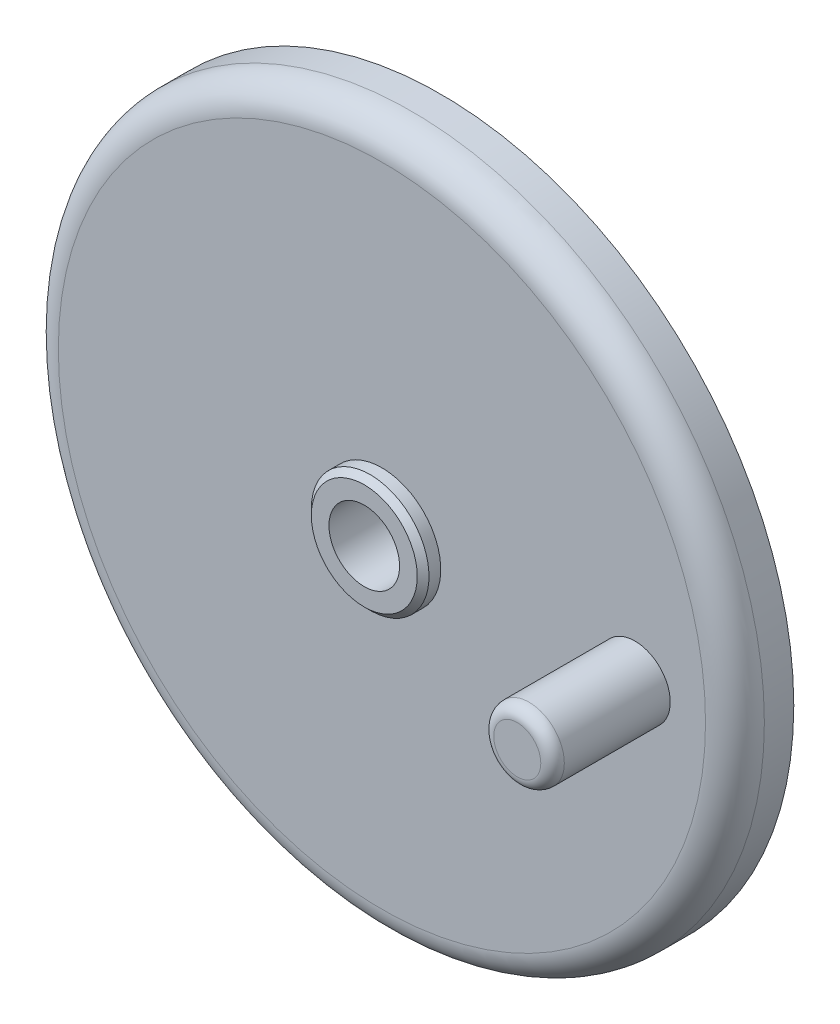
from build123d import *

# Parameters (mm, degrees)
SKETCH1_R           = 60
BOSS_EXTRUDE1_DEPTH = 10
FILLET1_R           = 5
SKETCH2_R           = 10
BOSS_EXTRUDE3_DEPTH = 13
SKETCH2_3_R         = 6
CUT_EXTRUDE1_DEPTH  = 86.842879728
CHAMFER1_SIZE       = 1
SKETCH3_R           = 6
BOSS_EXTRUDE4_DEPTH = 30
FILLET2_R           = 2


with BuildPart() as part:
    # Sketch1 → Boss-Extrude1 (new body)
    with BuildSketch(Plane.XY):
        Circle(SKETCH1_R)
    extrude(amount=BOSS_EXTRUDE1_DEPTH)

    # Fillet1
    fillet1_edges = [part.edges().sort_by_distance(p)[0] for p in [
        (-60, 0, 10),
    ]]
    fillet(fillet1_edges, radius=FILLET1_R)

    # Sketch2 → Boss-Extrude3 (add)
    with BuildSketch(Plane.XY):
        Circle(SKETCH2_R)
    extrude(amount=BOSS_EXTRUDE3_DEPTH)

    # Sketch2<3> → Cut-Extrude1 (cut, through all)
    with BuildSketch(Plane.XY):
        Circle(SKETCH2_3_R)
    extrude(amount=CUT_EXTRUDE1_DEPTH, mode=Mode.SUBTRACT)

    # Chamfer1
    chamfer1_edges = [part.edges().sort_by_distance(p)[0] for p in [
        (-10, 0, 13),
    ]]
    chamfer(chamfer1_edges, length=CHAMFER1_SIZE)

    # Sketch3 → Boss-Extrude4 (add)
    with BuildSketch(Plane.XY):
        with Locations((43, 0)):
            Circle(SKETCH3_R)
    extrude(amount=BOSS_EXTRUDE4_DEPTH)

    # Fillet2
    fillet2_edges = [part.edges().sort_by_distance(p)[0] for p in [
        (37, 0, 30),
    ]]
    fillet(fillet2_edges, radius=FILLET2_R)


solid = part.part
